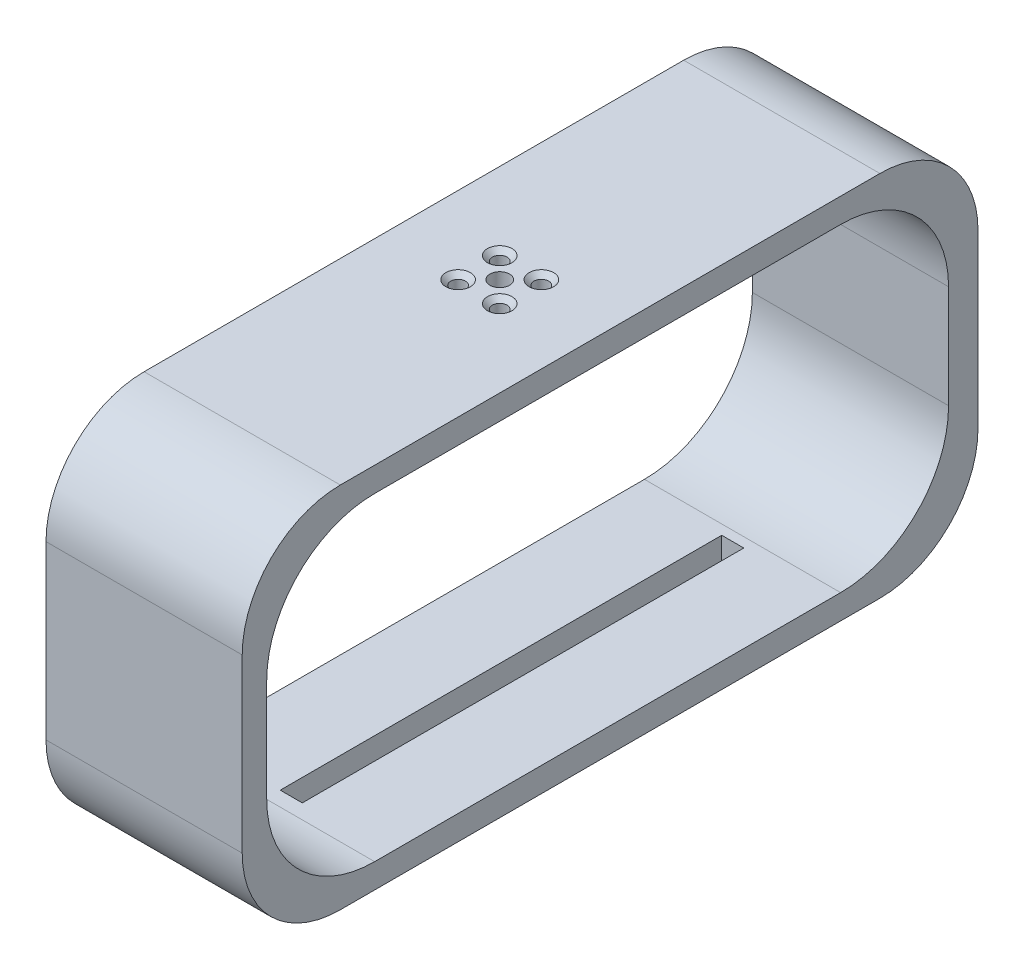
from build123d import *

# Parameters (mm, degrees)
BOSS_EXTRUDE1_DEPTH = 20
SKETCH3_W           = 4.5
SKETCH3_H           = 90
CUT_EXTRUDE2_DEPTH  = 10
SKETCH4_R           = 1.5
SKETCH4_R_2         = 2
CUT_EXTRUDE3_DEPTH  = 10
CHAMFER1_SIZE       = 1
FILLET1_R           = 22
FILLET2_R           = 20


with BuildPart() as part:
    # Sketch1 → Boss-Extrude1 (new, symmetric)
    with BuildSketch(Plane(origin=(0, 0, 0), x_dir=(0, 0, -1), z_dir=(1, 0, 0))):
        Polygon((0, 0), (150, 0), (150, 3), (150, 75), (120, 75), (0, 75), align=None)
        Polygon((144, 5), (5, 5), (5, 70), (120, 70), (144, 70), align=None, mode=Mode.SUBTRACT)
    extrude(amount=BOSS_EXTRUDE1_DEPTH, both=True)

    # Sketch3 → Cut-Extrude2 (cut)
    with BuildSketch(Plane.XZ):
        with Locations((0, -75)):
            Rectangle(SKETCH3_W, SKETCH3_H)
    extrude(amount=-CUT_EXTRUDE2_DEPTH, mode=Mode.SUBTRACT)

    # Sketch4 → Cut-Extrude3 (cut)
    with BuildSketch(Plane(origin=(0, 75, 0), x_dir=(1, 0, 0), z_dir=(0, 1, 0))):
        with Locations(Location((-4.242640687, 76.742640687, 0), (0, 0, 270))):
            Circle(SKETCH4_R)
        with Locations(Location((4.242640687, 76.742640687, 0), (0, 0, 270))):
            Circle(SKETCH4_R)
        with Locations(Location((4.242640687, 68.257359313, 0), (0, 0, 270))):
            Circle(SKETCH4_R)
        with Locations(Location((-4.242640687, 68.257359313, 0), (0, 0, 270))):
            Circle(SKETCH4_R)
        with Locations(Location((0, 72.5, 0), (0, 0, 270))):
            Circle(SKETCH4_R_2)
    extrude(amount=-CUT_EXTRUDE3_DEPTH, mode=Mode.SUBTRACT)

    # Chamfer1
    chamfer1_edges = [part.edges().sort_by_distance(p)[0] for p in [
        (-4.242640687, 75, -78.242640687),
        (4.242640687, 75, -78.242640687),
        (4.242640687, 75, -69.757359313),
        (-4.242640687, 75, -69.757359313),
    ]]
    chamfer(chamfer1_edges, length=CHAMFER1_SIZE)

    # Fillet1
    fillet1_edges = [part.edges().sort_by_distance(p)[0] for p in [
        (0, 70, -5),
        (0, 5, -5),
        (0, 5, -144),
        (0, 70, -144),
    ]]
    fillet(fillet1_edges, radius=FILLET1_R)

    # Fillet2
    fillet2_edges = [part.edges().sort_by_distance(p)[0] for p in [
        (0, 75, 0),
        (0, 75, -150),
        (0, 0, -150),
        (0, 0, 0),
    ]]
    fillet(fillet2_edges, radius=FILLET2_R)


solid = part.part
